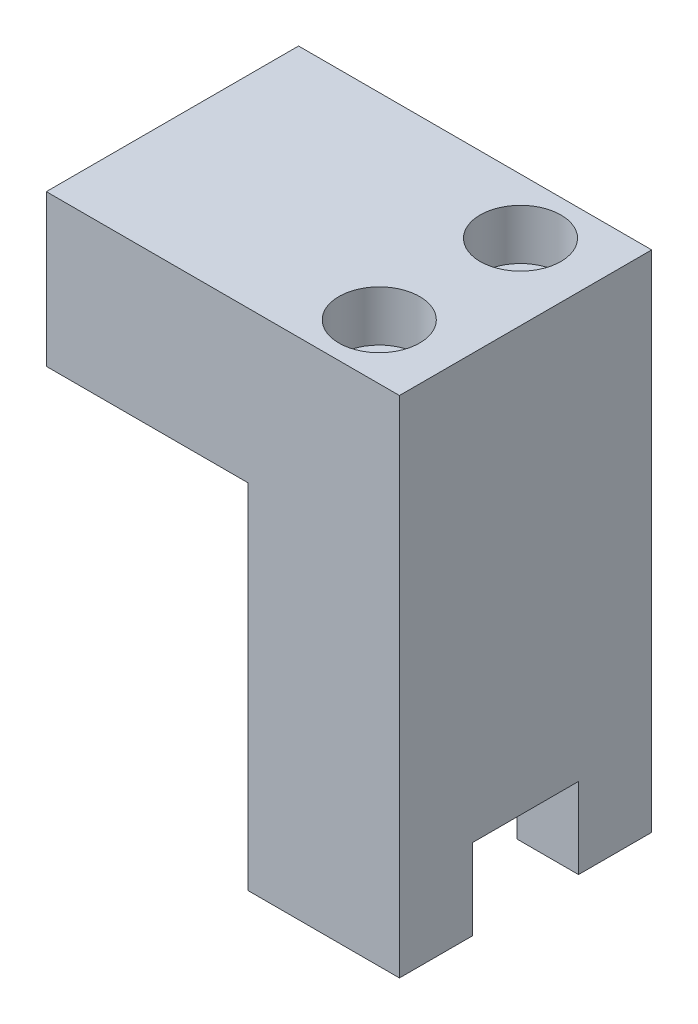
from build123d import *

# Parameters (mm, degrees)
EXTRUDE_1_DEPTH     = 25
SKETCH_2_R          = 2.25
CUT_EXTRUDE_1_DEPTH = 66.954529791
SKETCH_3_R          = 4
CUT_EXTRUDE_2_DEPTH = 5
SKETCH_4_W          = 10.5
SKETCH_4_H          = 16
CUT_EXTRUDE_5_DEPTH = 66.954529791


with BuildPart() as part:
    # 草图1 → 凸台-拉伸1 (new body)
    with BuildSketch(Plane.XY):
        Polygon((0, 0), (35, 0), (35, -50), (20, -50), (20, -15), (0, -15), align=None)
    extrude(amount=EXTRUDE_1_DEPTH)

    # 草图2 → 切除-拉伸1 (cut, through all)
    with BuildSketch(Plane(origin=(0, 0, 0), x_dir=(1, 0, 0), z_dir=(0, 1, 0))):
        with Locations(Location((27.5, -5.5, 0), (0, 0, 270))):
            Circle(SKETCH_2_R)
        with Locations(Location((27.5, -19.5, 0), (0, 0, 270))):
            Circle(SKETCH_2_R)
    extrude(amount=-CUT_EXTRUDE_1_DEPTH, mode=Mode.SUBTRACT)

    # 草图3 → 切除-拉伸2 (cut)
    with BuildSketch(Plane(origin=(0, 0, 0), x_dir=(1, 0, 0), z_dir=(0, 1, 0))):
        with Locations(Location((27.5, -5.5, 0), (0, 0, 270))):
            Circle(SKETCH_3_R)
        with Locations(Location((27.5, -19.5, 0), (0, 0, 270))):
            Circle(SKETCH_3_R)
    extrude(amount=-CUT_EXTRUDE_2_DEPTH, mode=Mode.SUBTRACT)

    # 草图4 → 切除-拉伸5 (cut, through all)
    with BuildSketch(Plane(origin=(35, 0, 0), x_dir=(0, 0, -1), z_dir=(1, 0, 0))):
        with Locations((-12.5, -50)):
            Rectangle(SKETCH_4_W, SKETCH_4_H)
    extrude(amount=-CUT_EXTRUDE_5_DEPTH, mode=Mode.SUBTRACT)


solid = part.part
